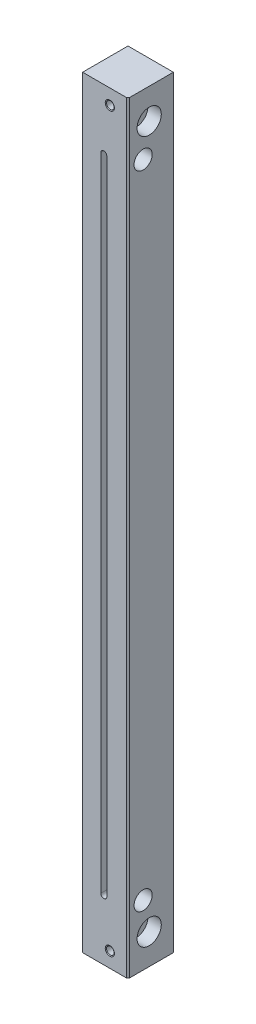
from build123d import *

# Parameters (mm, degrees)
SKETCH_1_W                  = 15
SKETCH_1_H                  = 252
EXTRUDE_1_DEPTH             = 15
EXTRUDE_2_DEPTH             = 6
SKETCH_3_W                  = 8
SKETCH_3_H                  = 225
CUT_EXTRUDE_1_DEPTH         = 253.891280988
SKETCH_7_W                  = 15
SKETCH_7_H                  = 6
CUT_EXTRUDE_4_DEPTH         = 245.863737617
SKETCH_5_W                  = 8
SKETCH_5_H                  = 225
EXTRUDE_3_DEPTH             = 3
CUT_EXTRUDE_3_DEPTH         = 8
FILLET_1_R                  = 5
CHAMFER_1_SIZE              = 0.5
HOLE_WIZARD_M31_D           = 2.5
HOLE_WIZARD_M31_DEPTH       = 8.5
HOLE_WIZARD_M31_CSINK_D     = 3.05
HOLE_WIZARD_M31_CSINK_ANGLE = 120
HOLE_WIZARD_M31_TIP         = 0.751075774
HOLE_WIZARD_M41_D           = 4.5
HOLE_WIZARD_M41_CBORE_D     = 8
HOLE_WIZARD_M41_CBORE_DEPTH = 4.4
SKETCH_12_R                 = 3
CUT_EXTRUDE_5_DEPTH         = 5
CHAMFER_2_SIZE              = 1
HOLE_WIZARD_M21_D           = 1.6
HOLE_WIZARD_M21_DEPTH       = 6
HOLE_WIZARD_M21_CSINK_D     = 2.05
HOLE_WIZARD_M21_CSINK_ANGLE = 120
HOLE_WIZARD_M21_TIP         = 0.480688495


with BuildPart() as part:
    # Эскиз1 → Бобышка-Вытянуть1 (new body)
    with BuildSketch(Plane.XY):
        with Locations((7.5, 126)):
            Rectangle(SKETCH_1_W, SKETCH_1_H)
    extrude(amount=EXTRUDE_1_DEPTH)

    # Эскиз2 → Бобышка-Вытянуть2 (add)
    with BuildSketch(Plane.XY.offset(15)):
        Polygon((15, 8.5), (15, 243.5), (0, 243.5), (0, 238.5), (8, 238.5), (8, 13.5), (0, 13.5), (0, 8.5), align=None)
    extrude(amount=EXTRUDE_2_DEPTH)

    # Эскиз3 → Вырез-Вытянуть1 (cut, through all)
    with BuildSketch(Plane.XY.offset(15)):
        with Locations((4, 126)):
            Rectangle(SKETCH_3_W, SKETCH_3_H)
    extrude(amount=-CUT_EXTRUDE_1_DEPTH, mode=Mode.SUBTRACT)

    # Эскиз7 → Вырез-Вытянуть4 (cut, through all)
    with BuildSketch(Plane(origin=(0, 243.5, 0), x_dir=(1, 0, 0), z_dir=(0, 1, 0))):
        with Locations((7.5, -18)):
            Rectangle(SKETCH_7_W, SKETCH_7_H)
    extrude(amount=-CUT_EXTRUDE_4_DEPTH, mode=Mode.SUBTRACT)

    # Эскиз5 → Бобышка-Вытянуть3 (add)
    with BuildSketch(Plane.XY.offset(15)):
        with Locations((4, 126)):
            Rectangle(SKETCH_5_W, SKETCH_5_H)
    extrude(amount=-EXTRUDE_3_DEPTH)

    # Эскиз6 → Вырез-Вытянуть3 (cut)
    with BuildSketch(Plane.XY.offset(15)):
        with BuildLine():
            Line((8, 232), (8, 20))
            ThreePointArc((8, 20), (7, 19), (6, 20))
            Line((6, 20), (6, 232))
            ThreePointArc((6, 232), (7, 233), (8, 232))
        make_face()
    extrude(amount=-CUT_EXTRUDE_3_DEPTH, mode=Mode.SUBTRACT)

    # Скругление1
    fillet_1_edges = [part.edges().sort_by_distance(p)[0] for p in [
        (4, 238.5, 12),
        (4, 13.5, 12),
    ]]
    fillet(fillet_1_edges, radius=FILLET_1_R)

    # Фаска1
    chamfer_1_edges = [part.edges().sort_by_distance(p)[0] for p in [
        (15, 126, 15),
    ]]
    chamfer(chamfer_1_edges, length=CHAMFER_1_SIZE)

    # Отверстие обработанное метчиком M31
    with Locations(Plane.XY.offset(15)):
        with Locations((9, 5), (9, 247)):
            CounterSinkHole(HOLE_WIZARD_M31_D / 2, HOLE_WIZARD_M31_CSINK_D / 2, depth=HOLE_WIZARD_M31_DEPTH, counter_sink_angle=HOLE_WIZARD_M31_CSINK_ANGLE)
            with Locations((0, 0, -(HOLE_WIZARD_M31_DEPTH + HOLE_WIZARD_M31_TIP / 2))):  # 118° drill point
                Cone(0, HOLE_WIZARD_M31_D / 2, HOLE_WIZARD_M31_TIP, mode=Mode.SUBTRACT)

    # Цековка для  винта с внутренним шестигранником M41 (through all)
    with Locations(Plane(origin=(15, 0, 0), x_dir=(0, 0, -1), z_dir=(1, 0, 0))):
        with Locations((-8, 10), (-8, 242)):
            CounterBoreHole(HOLE_WIZARD_M41_D / 2, HOLE_WIZARD_M41_CBORE_D / 2, HOLE_WIZARD_M41_CBORE_DEPTH)

    # Эскиз12 → Вырез-Вытянуть5 (cut)
    with BuildSketch(Plane(origin=(15, 0, 0), x_dir=(0, 0, -1), z_dir=(1, 0, 0))):
        with Locations((-10, 232)):
            Circle(SKETCH_12_R)
        with Locations((-10, 20)):
            Circle(SKETCH_12_R)
    extrude(amount=-CUT_EXTRUDE_5_DEPTH, mode=Mode.SUBTRACT)

    # Фаска2
    chamfer_2_edges = [part.edges().sort_by_distance(p)[0] for p in [
        (8, 126, 0),
    ]]
    chamfer(chamfer_2_edges, length=CHAMFER_2_SIZE)

    # Отверстие обработанное метчиком M21
    with Locations(Plane(origin=(0, 0, 0), x_dir=(-1, 0, 0), z_dir=(0, 0, -1))):
        with Locations((-12, 101), (-12, 201), (-12, 151), (-12, 51)):
            CounterSinkHole(HOLE_WIZARD_M21_D / 2, HOLE_WIZARD_M21_CSINK_D / 2, depth=HOLE_WIZARD_M21_DEPTH, counter_sink_angle=HOLE_WIZARD_M21_CSINK_ANGLE)
            with Locations((0, 0, -(HOLE_WIZARD_M21_DEPTH + HOLE_WIZARD_M21_TIP / 2))):  # 118° drill point
                Cone(0, HOLE_WIZARD_M21_D / 2, HOLE_WIZARD_M21_TIP, mode=Mode.SUBTRACT)


solid = part.part
